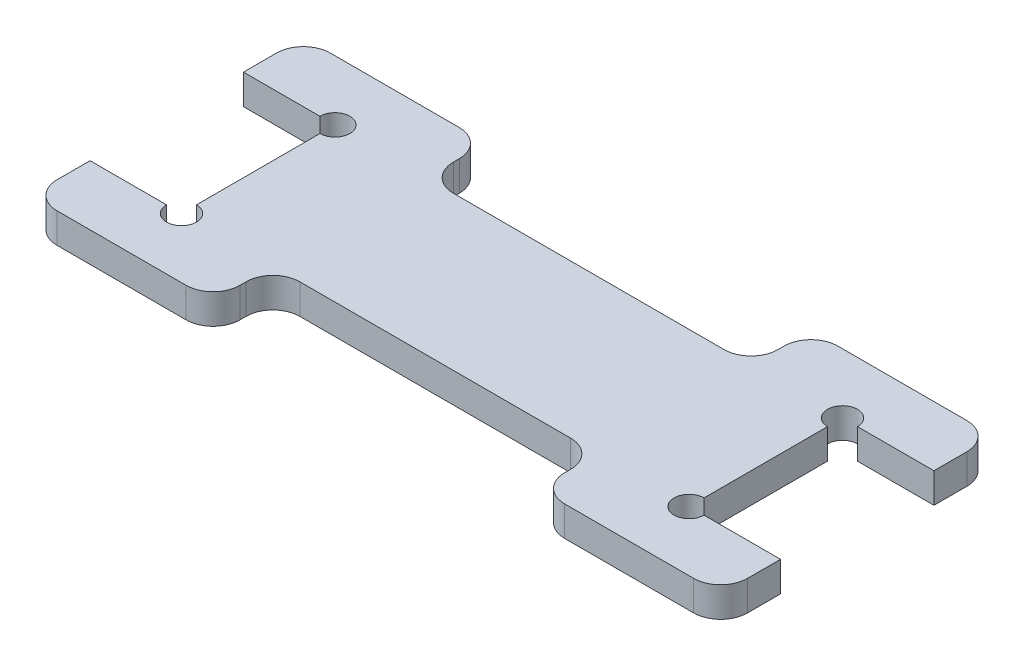
from build123d import *

# Parameters (mm, degrees)
BOSS_EXTRUDE1_DEPTH = 5
FILLET1_R           = 4.5


with BuildPart() as part:
    # Sketch1 → Boss-Extrude1 (new body)
    with BuildSketch(Plane(origin=(0, 0, 0), x_dir=(1, 0, 0), z_dir=(0, 1, 0))):
        with BuildLine():
            ThreePointArc((-44.85, 12.8), (-42.35, 15.3), (-39.85, 12.8))
            Line((-39.85, 12.8), (-27.09, 12.8))
            Line((-27.09, 12.8), (-27.09, 22.8))
            Line((-27.09, 22.8), (-57.61, 22.8))
            Line((-57.61, 22.8), (-57.61, 12.8))
            Line((-57.61, 12.8), (-44.85, 12.8))
        make_face()
        with BuildLine():
            ThreePointArc((-42.35, -10.3), (-40.582233047, -11.032233047), (-39.85, -12.8))
            Line((-39.85, -12.8), (-27.09, -12.8))
            Line((-27.09, -12.8), (27.09, -12.8))
            Line((27.09, -12.8), (39.85, -12.8))
            ThreePointArc((39.85, -12.8), (40.582233047, -11.032233047), (42.35, -10.3))
            Line((42.35, -10.3), (42.35, 10.3))
            ThreePointArc((42.35, 10.3), (40.582233047, 11.032233047), (39.85, 12.8))
            Line((39.85, 12.8), (27.09, 12.8))
            Line((27.09, 12.8), (-27.09, 12.8))
            Line((-27.09, 12.8), (-39.85, 12.8))
            ThreePointArc((-39.85, 12.8), (-40.582233047, 11.032233047), (-42.35, 10.3))
            Line((-42.35, 10.3), (-42.35, -10.3))
        make_face()
        with BuildLine():
            Line((-44.85, -12.8), (-57.61, -12.8))
            Line((-57.61, -12.8), (-57.61, -22.8))
            Line((-57.61, -22.8), (-27.09, -22.8))
            Line((-27.09, -22.8), (-27.09, -12.8))
            Line((-27.09, -12.8), (-39.85, -12.8))
            ThreePointArc((-39.85, -12.8), (-42.35, -15.3), (-44.85, -12.8))
        make_face()
        with BuildLine():
            Line((39.85, -12.8), (27.09, -12.8))
            Line((27.09, -12.8), (27.09, -22.8))
            Line((27.09, -22.8), (57.61, -22.8))
            Line((57.61, -22.8), (57.61, -12.8))
            Line((57.61, -12.8), (44.85, -12.8))
            ThreePointArc((44.85, -12.8), (42.35, -15.3), (39.85, -12.8))
        make_face()
        with BuildLine():
            Line((27.09, 22.8), (27.09, 12.8))
            Line((27.09, 12.8), (39.85, 12.8))
            ThreePointArc((39.85, 12.8), (42.35, 15.3), (44.85, 12.8))
            Line((44.85, 12.8), (57.61, 12.8))
            Line((57.61, 12.8), (57.61, 22.8))
            Line((57.61, 22.8), (27.09, 22.8))
        make_face()
    extrude(amount=BOSS_EXTRUDE1_DEPTH)

    # Fillet1
    fillet1_edges = [part.edges().sort_by_distance(p)[0] for p in [
        (-57.61, 2.5, -22.8),
        (-27.09, 2.5, -22.8),
        (-27.09, 2.5, -12.8),
        (27.09, 2.5, -12.8),
        (27.09, 2.5, -22.8),
        (57.61, 2.5, -22.8),
        (57.61, 2.5, 22.8),
        (27.09, 2.5, 22.8),
        (27.09, 2.5, 12.8),
        (-27.09, 2.5, 12.8),
        (-27.09, 2.5, 22.8),
        (-57.61, 2.5, 22.8),
    ]]
    fillet(fillet1_edges, radius=FILLET1_R)


solid = part.part
